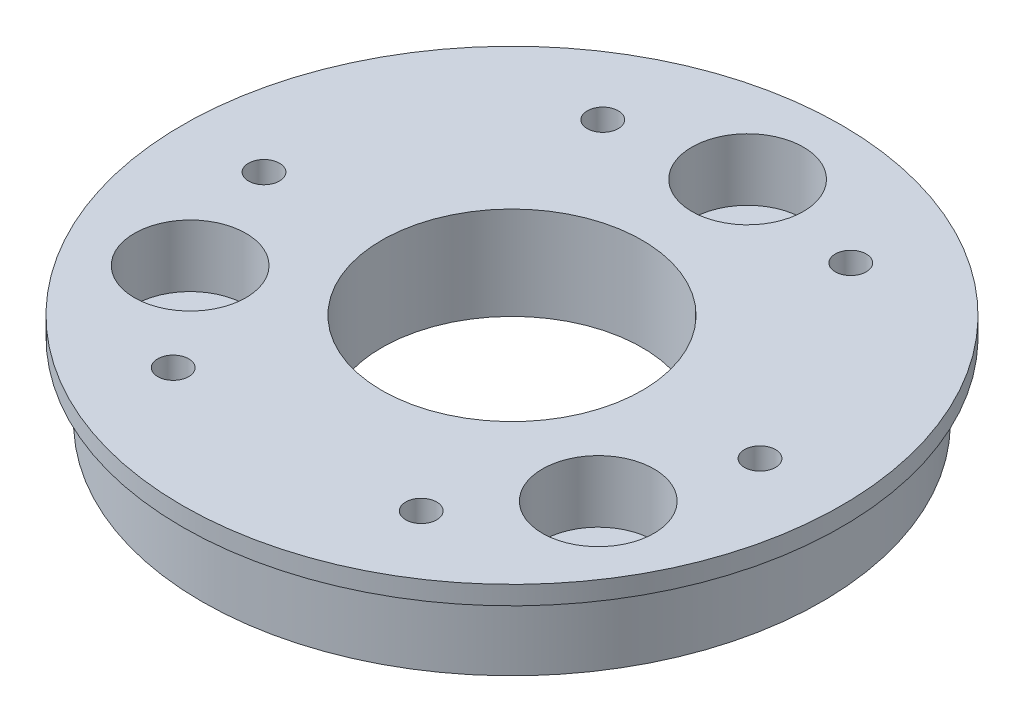
from build123d import *

# Parameters (mm, degrees)
SKETCH1_R                 = 25
BOSS_EXTRUDE1_DEPTH       = 6
CUT_EXTRUDE1_REACH        = 37.861
SKETCH2_R                 = 10.5
SKETCH3_R                 = 2.5
CUT_EXTRUDE2_DEPTH        = 36.860842154
SKETCH5_R                 = 1.25
CUT_EXTRUDE3_DEPTH        = 4
BOSS_EXTRUDE2_START       = 1.5
SKETCH6_R                 = 26.576681464
SKETCH6_R_2               = 10.5
SKETCH6_R_3               = 1.25
BOSS_EXTRUDE2_DEPTH       = 1.5
SKETCH7_R                 = 4.5
CUT_EXTRUDE4_DEPTH        = 5
SKETCH8_R                 = 2.5
BOSS_EXTRUDE3_DEPTH       = 3
M3X0_5_TAPPED_HOLE1_D     = 2.5
M3X0_5_TAPPED_HOLE1_DEPTH = 5
M3X0_5_TAPPED_HOLE1_TIP   = 0.751075774


with BuildPart() as part:
    # Sketch1 → Boss-Extrude1 (new body)
    with BuildSketch(Plane(origin=(0, 0, 0), x_dir=(1, 0, 0), z_dir=(0, 1, 0))):
        Circle(SKETCH1_R)
    extrude(amount=BOSS_EXTRUDE1_DEPTH)

    # Sketch2 → Cut-Extrude1 (cut, up to next)
    with BuildSketch(Plane(origin=(0, 6, 0), x_dir=(1, 0, 0), z_dir=(0, 1, 0)), mode=Mode.PRIVATE) as cut_extrude1_sk1:
        Circle(SKETCH2_R)
    cut_extrude1_tool1 = extrude(cut_extrude1_sk1.sketch, amount=-CUT_EXTRUDE1_REACH, mode=Mode.PRIVATE) & part.part
    add(cut_extrude1_tool1.solids().sort_by_distance((0, 6, 0))[0], mode=Mode.SUBTRACT)

    # Sketch3 → Cut-Extrude2 (cut, through all)
    with BuildSketch(Plane(origin=(0, 6, 0), x_dir=(1, 0, 0), z_dir=(0, 1, 0))):
        with Locations((0, 19)):
            Circle(SKETCH3_R)
        with Locations((16.454482672, 9.5)):
            Circle(SKETCH3_R)
        with Locations((16.454482672, -9.5)):
            Circle(SKETCH3_R)
        with Locations((0, -19)):
            Circle(SKETCH3_R)
        with Locations((-16.454482672, -9.5)):
            Circle(SKETCH3_R)
        with Locations((-16.454482672, 9.5)):
            Circle(SKETCH3_R)
    extrude(amount=-CUT_EXTRUDE2_DEPTH, mode=Mode.SUBTRACT)

    # Sketch5 → Cut-Extrude3 (cut)
    with BuildSketch(Plane(origin=(0, 6, 0), x_dir=(1, 0, 0), z_dir=(0, 1, 0))):
        with Locations((20, 0)):
            Circle(SKETCH5_R)
        with Locations((10, -17.320508076)):
            Circle(SKETCH5_R)
        with Locations((-10, -17.320508076)):
            Circle(SKETCH5_R)
        with Locations((-20, 0)):
            Circle(SKETCH5_R)
        with Locations((-10, 17.320508076)):
            Circle(SKETCH5_R)
        with Locations((10, 17.320508076)):
            Circle(SKETCH5_R)
    extrude(amount=-CUT_EXTRUDE3_DEPTH, mode=Mode.SUBTRACT)

    # Sketch6 → Boss-Extrude2 (add)
    with BuildSketch(Plane(origin=(0, 6, 0), x_dir=(1, 0, 0), z_dir=(0, 1, 0)).offset(BOSS_EXTRUDE2_START)):
        Circle(SKETCH6_R)
        Circle(SKETCH6_R_2, mode=Mode.SUBTRACT)
        with Locations((10, -17.320508076)):
            Circle(SKETCH6_R_3, mode=Mode.SUBTRACT)
        with Locations((-10, -17.320508076)):
            Circle(SKETCH6_R_3, mode=Mode.SUBTRACT)
        with Locations((-20, 0)):
            Circle(SKETCH6_R_3, mode=Mode.SUBTRACT)
        with Locations((-10, 17.320508076)):
            Circle(SKETCH6_R_3, mode=Mode.SUBTRACT)
        with Locations((10, 17.320508076)):
            Circle(SKETCH6_R_3, mode=Mode.SUBTRACT)
        with Locations((20, 0)):
            Circle(SKETCH6_R_3, mode=Mode.SUBTRACT)
    extrude(amount=-BOSS_EXTRUDE2_DEPTH)

    # Sketch7 → Cut-Extrude4 (cut)
    with BuildSketch(Plane(origin=(0, 7.5, 0), x_dir=(1, 0, 0), z_dir=(0, 1, 0))):
        with Locations((16.454482672, -9.5)):
            Circle(SKETCH7_R)
        with Locations((-16.454482672, -9.5)):
            Circle(SKETCH7_R)
        with Locations((0, 19)):
            Circle(SKETCH7_R)
    extrude(amount=-CUT_EXTRUDE4_DEPTH, mode=Mode.SUBTRACT)

    # Sketch8 → Boss-Extrude3 (add)
    with BuildSketch(Plane.XZ.offset(-6)):
        with Locations((0, 19)):
            Circle(SKETCH8_R)
        with Locations((16.454482672, -9.5)):
            Circle(SKETCH8_R)
        with Locations((-16.454482672, -9.5)):
            Circle(SKETCH8_R)
    extrude(amount=BOSS_EXTRUDE3_DEPTH)

    # M3x0.5 Tapped Hole1
    with Locations(Plane(origin=(0, 7.5, 0), x_dir=(1, 0, 0), z_dir=(0, 1, 0))):
        with Locations((-10, 17.320508076), (-20, 0), (-10, -17.320508076), (10, 17.320508076), (20, 0), (10, -17.320508076)):
            Hole(M3X0_5_TAPPED_HOLE1_D / 2, depth=M3X0_5_TAPPED_HOLE1_DEPTH)
            with Locations((0, 0, -(M3X0_5_TAPPED_HOLE1_DEPTH + M3X0_5_TAPPED_HOLE1_TIP / 2))):  # 118° drill point
                Cone(0, M3X0_5_TAPPED_HOLE1_D / 2, M3X0_5_TAPPED_HOLE1_TIP, mode=Mode.SUBTRACT)


solid = part.part
